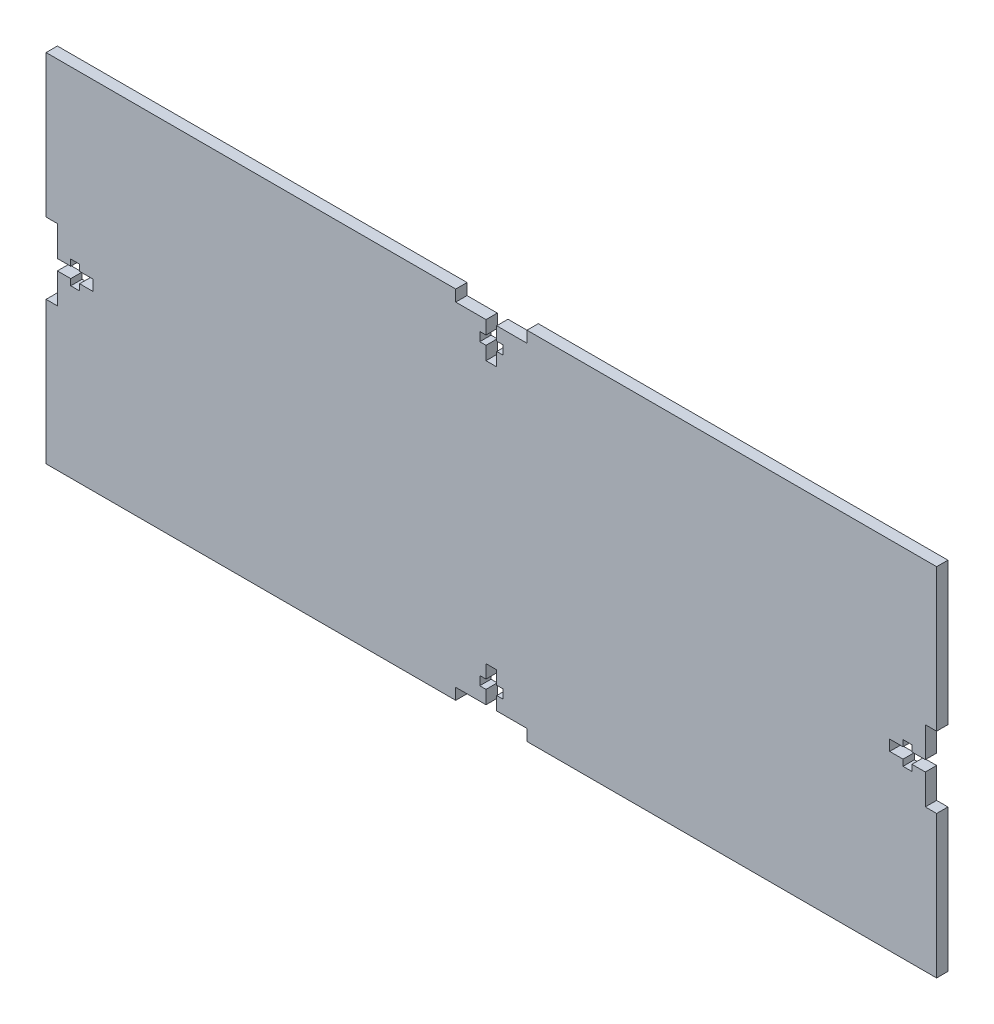
from build123d import *

# Parameters (mm, degrees)
SKETCH1_W           = 250
SKETCH1_H           = 100
BOSS_EXTRUDE1_DEPTH = 3.175
T_CUT_DEPTH         = 142.561231774
T_CUT2_DEPTH        = 149.1205851
T_CUT3_DEPTH        = 143.57254352


with BuildPart() as part:
    # Sketch1 → Boss-Extrude1 (new body)
    with BuildSketch(Plane.XY):
        Rectangle(SKETCH1_W, SKETCH1_H)
    extrude(amount=BOSS_EXTRUDE1_DEPTH)

    # Sketch3 → T Cut (cut, through all)
    with BuildSketch(Plane(origin=(2.435372351, -11.560763397, 0), x_dir=(-1, 0, 0), z_dir=(0, 0, -1))):
        Polygon((-122.564627649, 1.560763397), (-122.564627649, 21.560763397), (-119.389627649, 21.560763397), (-119.389627649, 13.060763397), (-115.639627649, 13.060763397), (-115.639627649, 14.810763397), (-113.139627649, 14.810763397), (-113.139627649, 13.060763397), (-109.389627649, 13.060763397), (-109.389627649, 10.060763397), (-113.139627649, 10.060763397), (-113.139627649, 8.310763397), (-115.639627649, 8.310763397), (-115.639627649, 10.060763397), (-119.389627649, 10.060763397), (-119.389627649, 1.560763397), align=None)
    extrude(amount=-T_CUT_DEPTH, mode=Mode.SUBTRACT)

    # Sketch32 → T Cut2 (cut, through all)
    with BuildSketch(Plane(origin=(-11.542281755, -7.322180687, 3.175), x_dir=(1, 0, 0), z_dir=(0, 0, 1))):
        Polygon((-113.457718245, -2.677819313), (-113.457718245, 17.322180687), (-110.282718245, 17.322180687), (-110.282718245, 8.822180687), (-106.532718245, 8.822180687), (-106.532718245, 10.572180687), (-104.032718245, 10.572180687), (-104.032718245, 8.822180687), (-100.282718245, 8.822180687), (-100.282718245, 5.822180687), (-104.032718245, 5.822180687), (-104.032718245, 4.072180687), (-106.532718245, 4.072180687), (-106.532718245, 5.822180687), (-110.282718245, 5.822180687), (-110.282718245, -2.677819313), align=None)
    extrude(amount=-T_CUT2_DEPTH, mode=Mode.SUBTRACT)

    # Sketch33 → T Cut3 (cut, through all)
    with BuildSketch(Plane(origin=(-8.380029994, 0.26546667, 0), x_dir=(-1, 0, 0), z_dir=(0, 0, -1))):
        Polygon((-18.380029994, 49.73453333), (1.619970006, 49.73453333), (1.619970006, 46.55953333), (-6.880029994, 46.55953333), (-6.880029994, 42.80953333), (-5.130029994, 42.80953333), (-5.130029994, 40.30953333), (-6.880029994, 40.30953333), (-6.880029994, 36.55953333), (-9.880029994, 36.55953333), (-9.880029994, 40.30953333), (-11.630029994, 40.30953333), (-11.630029994, 42.80953333), (-9.880029994, 42.80953333), (-9.880029994, 46.55953333), (-18.380029994, 46.55953333), align=None)
    t_cut3 = extrude(amount=-T_CUT3_DEPTH, mode=Mode.SUBTRACT)

    # Mirror2: T Cut3 across plane
    add(t_cut3.mirror(Plane.ZX), mode=Mode.SUBTRACT)


solid = part.part
